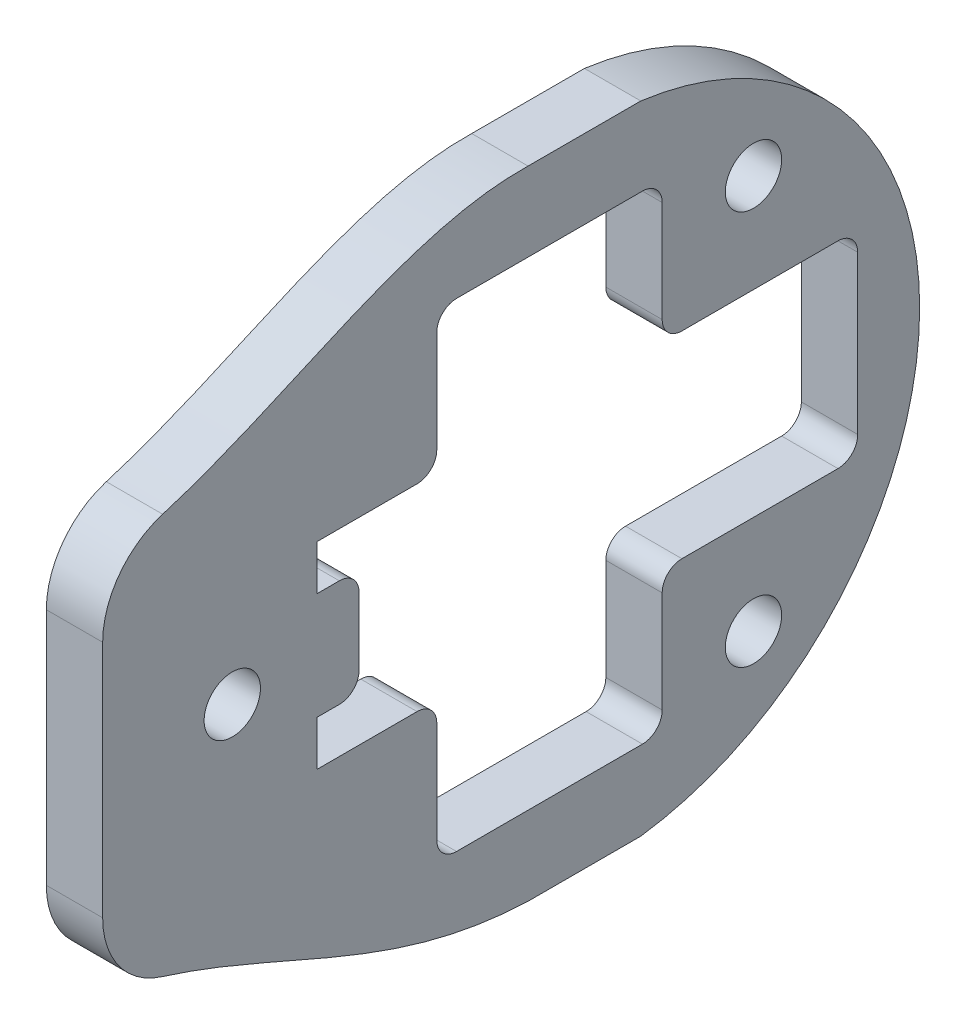
from build123d import *

# Parameters (mm, degrees)
SCHIZZO1_R                   = 1
ESTRUSIONE_ESTRUSIONE1_DEPTH = 2
RACCORDO2_R                  = 3
RACCORDO3_R                  = 3
RACCORDO4_R                  = 0.7
RACCORDO5_R                  = 0.7


with BuildPart() as part:
    # Schizzo1 → Estrusione-Estrusione1 (new body)
    with BuildSketch(Plane(origin=(0, 0, 0), x_dir=(0, 0, -1), z_dir=(1, 0, 0))):
        with BuildLine():
            add(Edge.make_bspline(
                [(-7.501010101, -10.3), (-10.845030199, -9.13986581), (-13.865102381, -7.304364218), (-17.601010101, -6.594005849)],
                knots=[0.271280726, 0.271280726, 0.271280726, 0.271280726, 0.852483684, 0.852483684, 0.852483684, 0.852483684], degree=3))
            add(Edge.make_bspline(
                [(-2.501010101, -11.3), (-4.308742426, -11.235865063), (-5.940164296, -10.841501107), (-7.501010101, -10.3)],
                knots=[0, 0, 0, 0, 0.271280726, 0.271280726, 0.271280726, 0.271280726], degree=3))
            Line((-2.501010101, -11.3), (1.498989899, -11.3))
            ThreePointArc((1.498989899, -11.3), (11.398989899, 0), (1.498989899, 11.3))
            Line((1.498989899, 11.3), (-2.501010101, 11.3))
            add(Edge.make_bspline(
                [(-2.501010101, 11.3), (-4.209338931, 11.338090952), (-5.850739142, 10.914740779), (-7.501010101, 10.3)],
                knots=[0, 0, 0, 0, 0.293888871, 0.293888871, 0.293888871, 0.293888871], degree=3))
            add(Edge.make_bspline(
                [(-7.501010101, 10.3), (-10.658273676, 9.123890914), (-13.848006436, 7.247243694), (-17.601010101, 6.561146452)],
                knots=[0.293888871, 0.293888871, 0.293888871, 0.293888871, 0.856150858, 0.856150858, 0.856150858, 0.856150858], degree=3))
            Line((-17.601010101, 6.561146452), (-17.601010101, 0))
            Line((-17.601010101, 0), (-17.601010101, -6.594005849))
        make_face()
        Polygon((-8.5, 1.9), (-10, 1.9), (-10, 3.5), (-5.741010101, 3.5), (-5.741010101, 8.5), (2.258989899, 8.5), (2.258989899, 3.5), (9.198989899, 3.5), (9.198989899, -3.5), (2.258989899, -3.5), (2.258989899, -8.5), (-5.741010101, -8.5), (-5.741010101, -3.5), (-10, -3.5), (-10, -1.9), (-8.5, -1.9), align=None, mode=Mode.SUBTRACT)
        with BuildLine():
            ThreePointArc((-12, 0), (-13, -1), (-14, 0))
            ThreePointArc((-14, 0), (-13, 1), (-12, 0))
        make_face(mode=Mode.SUBTRACT)
        with Locations((5.5, -7)):
            Circle(SCHIZZO1_R, mode=Mode.SUBTRACT)
        with Locations((5.5, 7)):
            Circle(SCHIZZO1_R, mode=Mode.SUBTRACT)
    extrude(amount=ESTRUSIONE_ESTRUSIONE1_DEPTH)

    # Raccordo2
    raccordo2_edges = [part.edges().sort_by_distance(p)[0] for p in [
        (1, -6.594005849, 17.601010101),
    ]]
    fillet(raccordo2_edges, radius=RACCORDO2_R)

    # Raccordo3
    raccordo3_edges = [part.edges().sort_by_distance(p)[0] for p in [
        (1, 6.561146452, 17.601010101),
    ]]
    fillet(raccordo3_edges, radius=RACCORDO3_R)

    # Raccordo4
    raccordo4_edges = [part.edges().sort_by_distance(p)[0] for p in [
        (1, 3.5, -9.198989899),
        (1, 3.5, -2.258989899),
        (1, 8.5, -2.258989899),
        (1, 8.5, 5.741010101),
        (1, 3.5, 5.741010101),
        (1, -3.5, 5.741010101),
        (1, -8.5, 5.741010101),
        (1, -8.5, -2.258989899),
        (1, -3.5, -9.198989899),
        (1, -3.5, -2.258989899),
    ]]
    fillet(raccordo4_edges, radius=RACCORDO4_R)

    # Raccordo5
    raccordo5_edges = [part.edges().sort_by_distance(p)[0] for p in [
        (1, 1.9, 8.5),
        (1, -1.9, 8.5),
    ]]
    fillet(raccordo5_edges, radius=RACCORDO5_R)


solid = part.part
